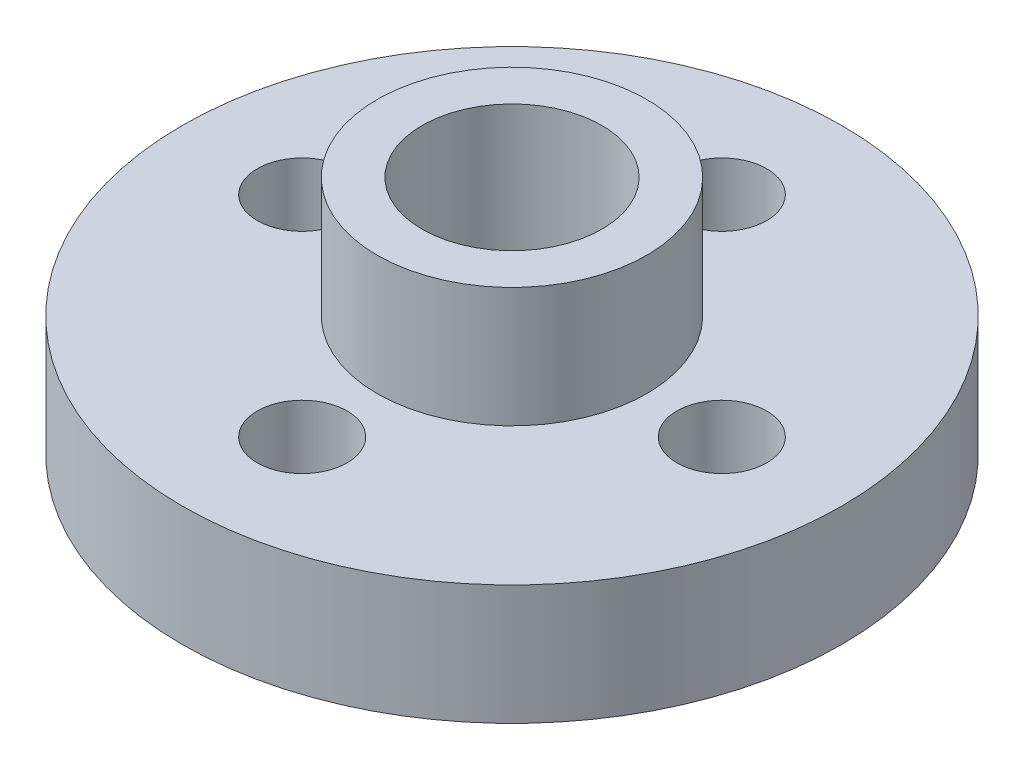
from build123d import *

# Parameters (mm, degrees)
SKETCH1_R           = 11
BOSS_EXTRUDE2_DEPTH = 8
SKETCH3_R           = 3
SKETCH3_R_2         = 1.5
CUT_EXTRUDE2_DEPTH  = 12
CUT_EXTRUDE3_START  = -4
SKETCH4_R           = 11
SKETCH4_R_2         = 4.5
CUT_EXTRUDE3_DEPTH  = 4


with BuildPart() as part:
    # Sketch1 → Boss-Extrude2 (new body)
    with BuildSketch(Plane(origin=(0, 0, 0), x_dir=(1, 0, 0), z_dir=(0, 1, 0))):
        with Locations(Location((0, 0, 0), (0, 0, 270))):
            Circle(SKETCH1_R)
    extrude(amount=BOSS_EXTRUDE2_DEPTH)

    # Sketch3 → Cut-Extrude2 (cut)
    with BuildSketch(Plane(origin=(0, 8, 0), x_dir=(1, 0, 0), z_dir=(0, 1, 0))):
        with Locations(Location((0, 0, 0), (0, 0, 270))):
            Circle(SKETCH3_R)
        with Locations(Location((-7, 0, 0), (0, 0, 270))):
            Circle(SKETCH3_R_2)
        with Locations(Location((0, 7, 0), (0, 0, 270))):
            Circle(SKETCH3_R_2)
        with Locations(Location((7, 0, 0), (0, 0, 270))):
            Circle(SKETCH3_R_2)
        with Locations(Location((0, -7, 0), (0, 0, 270))):
            Circle(SKETCH3_R_2)
    extrude(amount=-CUT_EXTRUDE2_DEPTH, mode=Mode.SUBTRACT)

    # Sketch4 → Cut-Extrude3 (cut)
    with BuildSketch(Plane(origin=(0, 8, 0), x_dir=(1, 0, 0), z_dir=(0, 1, 0)).offset(CUT_EXTRUDE3_START)):
        with Locations(Location((0, 0, 0), (0, 0, 270))):
            Circle(SKETCH4_R)
        with Locations(Location((0, 0, 0), (0, 0, 270))):
            Circle(SKETCH4_R_2, mode=Mode.SUBTRACT)
    extrude(amount=CUT_EXTRUDE3_DEPTH, mode=Mode.SUBTRACT)


solid = part.part
